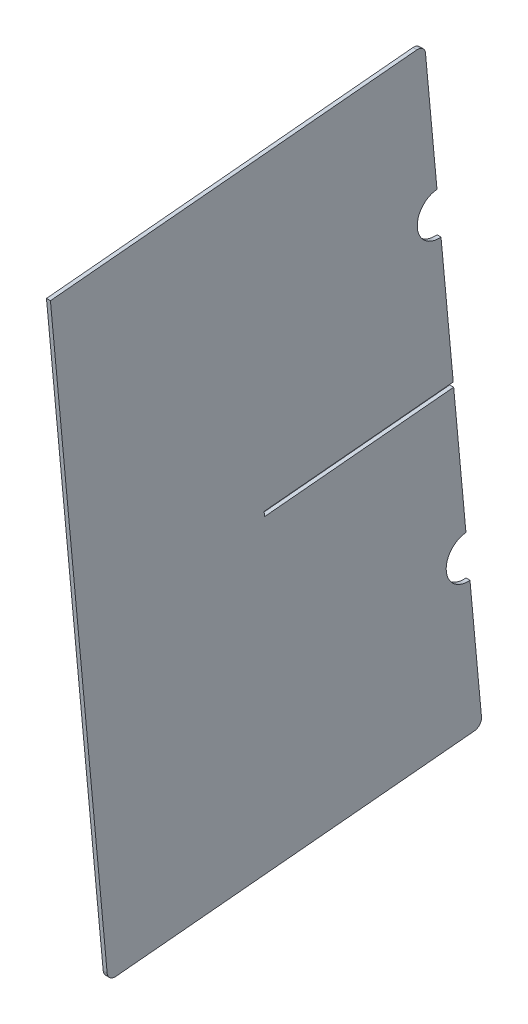
from build123d import *

# Parameters (mm, degrees)
EXTRUDE_1_DEPTH     = 1
CUT_EXTRUDE_1_DEPTH = 10
FILLET_1_R          = 2
FILLET_2_R          = 2


with BuildPart() as part:
    # 草图1 → 凸台-拉伸1 (new body)
    with BuildSketch(Plane(origin=(-61.5, 0, 0), x_dir=(0, -1, 0), z_dir=(-1, 0, 0))):
        with BuildLine():
            Line((145.112990447, 800.603209432), (176.378367534, 797.698696456))
            ThreePointArc((176.378367534, 797.698696456), (177.840703349, 798.15115608), (178.554793652, 799.505120921))
            Line((178.554793652, 799.505120921), (187.157332086, 892.106397006))
            Line((187.157332086, 892.106397006), (-47.830852387, 913.936494537))
            Line((-47.830852387, 913.936494537), (-56.433390821, 821.335218452))
            ThreePointArc((-56.433390821, 821.335218452), (-55.980931196, 819.872882636), (-54.626966355, 819.158792334))
            Line((-54.626966355, 819.158792334), (-23.361589268, 816.254279357))
            ThreePointArc((-23.361589268, 816.254279357), (-17.376417442, 821.221946637), (-12.408750162, 815.236774811))
            Line((-12.408750162, 815.236774811), (20.848052217, 812.147261008))
            Line((20.848052217, 812.147261008), (25.288072054, 859.941468019))
            Line((25.288072054, 859.941468019), (26.482927229, 859.830467523))
            Line((26.482927229, 859.830467523), (22.042907393, 812.036260512))
            Line((22.042907393, 812.036260512), (55.399281036, 808.937496668))
            ThreePointArc((55.399281036, 808.937496668), (61.384452862, 813.905163948), (66.352120143, 807.919992122))
            Line((66.352120143, 807.919992122), (99.708493786, 804.821228277))
            Line((99.708493786, 804.821228277), (104.148513623, 852.615435289))
            Line((104.148513623, 852.615435289), (105.343368798, 852.504434793))
            Line((105.343368798, 852.504434793), (100.903348961, 804.710227781))
            Line((100.903348961, 804.710227781), (134.16015134, 801.620713978))
            ThreePointArc((134.16015134, 801.620713978), (140.145323166, 806.588381259), (145.112990447, 800.603209432))
        make_face()
    extrude(amount=-EXTRUDE_1_DEPTH)

    # 草图2 → 切除-拉伸1 (cut)
    with BuildSketch(Plane(origin=(-60.5, 0, 0), x_dir=(0, 0, -1), z_dir=(1, 0, 0))):
        Polygon((-804.821228277, -99.708493786), (-899.413929654, -108.496033046), (-892.106397006, -187.157332086), (-797.513695629, -178.369792826), align=None)
    extrude(amount=-CUT_EXTRUDE_1_DEPTH, mode=Mode.SUBTRACT)

    # 圆角1
    fillet_1_edges = [part.edges().sort_by_distance(p)[0] for p in [
        (-61, -108.496033046, 899.413929654),
    ]]
    fillet(fillet_1_edges, radius=FILLET_1_R)

    # 圆角2
    fillet_2_edges = [part.edges().sort_by_distance(p)[0] for p in [
        (-61, -99.708493786, 804.821228277),
    ]]
    fillet(fillet_2_edges, radius=FILLET_2_R)


solid = part.part
